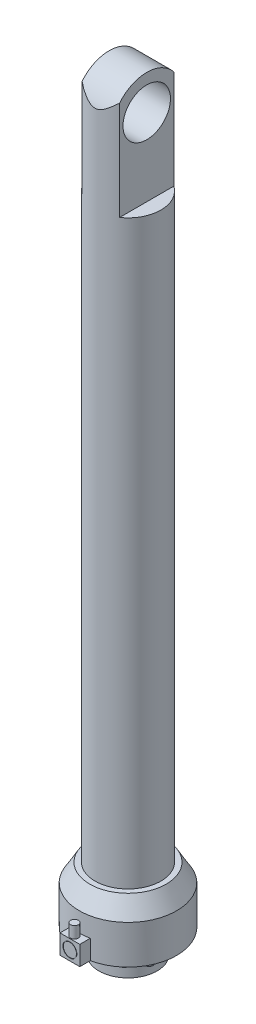
from build123d import *

# Parameters (mm, degrees)
SKETCH_1_R               = 8.5
EXTRUDE_1_DEPTH          = 150
SKETCH_2_W               = 9.66465271
SKETCH_2_H               = 17.929973808
EXTRUDE_2_DEPTH          = 20
SKETCH_3_R               = 8.930825741
EXTRUDE_3_DEPTH          = 9.7
SKETCH_4_R               = 6.125222913
CUT_EXTRUDE_1_DEPTH      = 9.7
CUT_EXTRUDE_2_DEPTH      = 180.35679912
CUT_EXTRUDE_2_DEPTH_BACK = 180.35679912
SKETCH_5_R               = 18.5
SKETCH_5_R_2             = 8.5
SKETCH_10_R              = 12.560047034
EXTRUDE_5_DEPTH          = 10
SKETCH_11_R              = 7.5
SKETCH_11_R_2            = 1
EXTRUDE_6_DEPTH          = 1
SKETCH_12_R              = 7.5
EXTRUDE_7_DEPTH          = 5
EXTRUDE_8_DEPTH          = 2
EXTRUDE_8_DEPTH_BACK     = 1
SKETCH_13_W              = 5.120094068
SKETCH_13_H              = 5
SKETCH_14_R              = 1
EXTRUDE_9_DEPTH          = 3
SKETCH_15_R              = 1.806178817
SKETCH_15_R_2            = 1.706178817
CUT_EXTRUDE_3_DEPTH      = 0.2
SKETCH_16_R              = 6
CUT_EXTRUDE_2_2_DEPTH    = 130.2


with BuildPart() as part:
    # 草圖1 → 填料-伸長1 (new body)
    with BuildSketch(Plane(origin=(0, 0, 0), x_dir=(1, 0, 0), z_dir=(0, 1, 0))):
        with Locations(Location((0, 0, 0), (0, 0, 270))):
            Circle(SKETCH_1_R)
    extrude(amount=EXTRUDE_1_DEPTH)

    # 草圖2 → 填料-伸長2 (add)
    with BuildSketch(Plane(origin=(0, 150, 0), x_dir=(1, 0, 0), z_dir=(0, 1, 0))):
        Rectangle(SKETCH_2_W, SKETCH_2_H)
    extrude(amount=EXTRUDE_2_DEPTH)

    # 草圖3 → 填料-伸長3 (add)
    with BuildSketch(Plane(origin=(4.832326355, 0, 0), x_dir=(0, 0, -1), z_dir=(1, 0, 0))):
        with Locations((0, 170)):
            Circle(SKETCH_3_R)
    extrude(amount=-EXTRUDE_3_DEPTH)

    # 草圖4 → 除料-伸長1 (cut)
    with BuildSketch(Plane(origin=(4.832326355, 0, 0), x_dir=(0, 0, -1), z_dir=(1, 0, 0))):
        with Locations((0, 170)):
            Circle(SKETCH_4_R)
    extrude(amount=-CUT_EXTRUDE_1_DEPTH, mode=Mode.SUBTRACT)

    # 草圖5 → Cut-Extrude 2 (cut, two sides: drawn at the far end of the back side and taken through both)
    with BuildSketch(Plane.XZ.offset(-CUT_EXTRUDE_2_DEPTH_BACK)):
        Circle(SKETCH_5_R)
        Circle(SKETCH_5_R_2, mode=Mode.SUBTRACT)
    extrude(amount=CUT_EXTRUDE_2_DEPTH + CUT_EXTRUDE_2_DEPTH_BACK, mode=Mode.SUBTRACT)

    # 草圖9 → 旋轉3 (revolve)
    with BuildSketch(Plane(origin=(0, 0, 0), x_dir=(0, 0, -1), z_dir=(1, 0, 0)), mode=Mode.PRIVATE) as revolve_3_sk:
        Polygon((0, 0), (-9.863847944, 0), (-12.560047034, -4.59966966), (0, -4.59966966), align=None)
    revolve(revolve_3_sk.sketch.rotate(Axis((0, -4.59966966, 0), (0, 1, 0)), 180), axis=Axis((0, -4.59966966, 0), (0, 1, 0)))

    # 草圖10 → 填料-伸長5 (add)
    with BuildSketch(Plane.XZ.offset(4.59966966)):
        with Locations(Location((0, 0, 0), (0, 0, 270))):
            Circle(SKETCH_10_R)
    extrude(amount=EXTRUDE_5_DEPTH)

    # 草圖11 → 填料-伸長6 (add)
    with BuildSketch(Plane.XZ.offset(14.59966966)):
        with Locations(Location((0, 0, 0), (0, 0, 270))):
            Circle(SKETCH_11_R)
        with Locations(Location((-7.188213253, 7.761132083, 0), (0, 0, 270))):
            Circle(SKETCH_11_R_2)
        with Locations(Location((-9.69284226, 4.320867156, 0), (0, 0, 270))):
            Circle(SKETCH_11_R_2)
        with Locations(Location((6.750188429, 7.761132083, 0), (0, 0, 270))):
            Circle(SKETCH_11_R_2)
        with Locations(Location((9.740976841, 4.320867156, 0), (0, 0, 270))):
            Circle(SKETCH_11_R_2)
        with Locations(Location((-3.170732664, -10.604081457, 0), (0, 0, 270))):
            Circle(SKETCH_11_R_2)
        with Locations(Location((2.605242012, -10.604081457, 0), (0, 0, 270))):
            Circle(SKETCH_11_R_2)
    extrude(amount=EXTRUDE_6_DEPTH)

    # 草圖12 → 填料-伸長7 (add)
    with BuildSketch(Plane.XZ.offset(15.59966966)):
        with Locations(Location((0, 0, 0), (0, 0, 270))):
            Circle(SKETCH_12_R)
    extrude(amount=EXTRUDE_7_DEPTH)

    # 草圖13 → 填料-伸長8 (add, two sides: drawn at the far end of the back side and taken through both)
    with BuildSketch(Plane.XY.offset(13).offset(-EXTRUDE_8_DEPTH_BACK)):
        with Locations((0, -12.09966966)):
            Rectangle(SKETCH_13_W, SKETCH_13_H)
    extrude(amount=EXTRUDE_8_DEPTH + EXTRUDE_8_DEPTH_BACK)

    # 草圖14 → 填料-伸長9 (add)
    with BuildSketch(Plane(origin=(0, -9.59966966, 0), x_dir=(1, 0, 0), z_dir=(0, 1, 0))):
        with Locations(Location((0, -13.8, 0), (0, 0, 270))):
            Circle(SKETCH_14_R)
    extrude(amount=EXTRUDE_9_DEPTH)

    # 草圖15 → 除料-伸長-薄件3 (cut)
    with BuildSketch(Plane.XY.offset(15)):
        with Locations((0, -12.122115246)):
            Circle(SKETCH_15_R)
        with Locations((0, -12.122115246)):
            Circle(SKETCH_15_R_2, mode=Mode.SUBTRACT)
    extrude(amount=-CUT_EXTRUDE_3_DEPTH, mode=Mode.SUBTRACT)

    # 草圖16 → Cut-Extrude 2 2 (cut)
    with BuildSketch(Plane.XZ.offset(20.59966966)):
        with Locations(Location((0, 0, 0), (0, 0, 270))):
            Circle(SKETCH_16_R)
    extrude(amount=-CUT_EXTRUDE_2_2_DEPTH, mode=Mode.SUBTRACT)


solid = part.part
